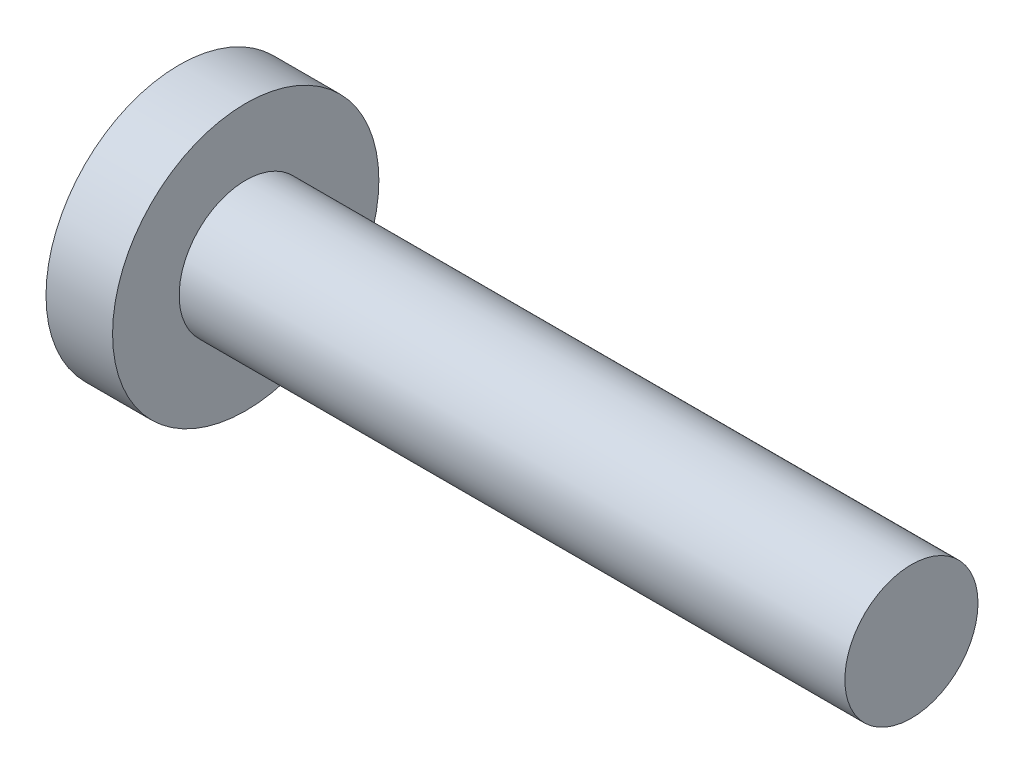
from build123d import *

# Parameters (mm, degrees)
SKETCH1_R           = 2.54
BOSS_EXTRUDE1_DEPTH = 25.4
SKETCH2_R           = 5.08
BOSS_EXTRUDE2_DEPTH = 2.54


with BuildPart() as part:
    # Sketch1 → Boss-Extrude1 (new body)
    with BuildSketch(Plane(origin=(0, 0, 0), x_dir=(0, 0, -1), z_dir=(1, 0, 0))):
        Circle(SKETCH1_R)
    extrude(amount=BOSS_EXTRUDE1_DEPTH)

    # Sketch2 → Boss-Extrude2 (add)
    with BuildSketch(Plane.ZY):
        Circle(SKETCH2_R)
    extrude(amount=BOSS_EXTRUDE2_DEPTH)


solid = part.part
